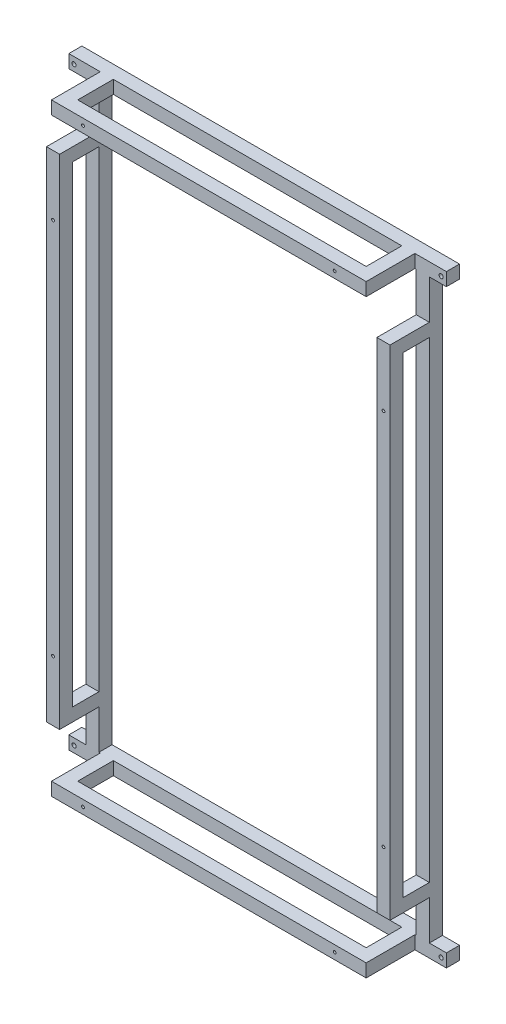
from build123d import *

# Parameters (mm, degrees)
ESQUISSE1_W                  = 720
ESQUISSE1_H                  = 25
BOSS_EXTRU_1_DEPTH           = 25
BOSS_EXTRU_1_2_DEPTH         = 25
ENL_V_MAT_EXTRU_1_DEPTH      = 25
ENL_V_MAT_EXTRU_1_DEPTH_BACK = 100
ESQUISSE2_R                  = 4
ESQUISSE3_W                  = 25
ESQUISSE3_H                  = 25
BOSS_EXTRU_2_DEPTH           = 68
ESQUISSE4_W                  = 600
ESQUISSE4_H                  = 25
BOSS_EXTRU_3_DEPTH           = 25
ESQUISSE5_R                  = 2.75
ENL_V_MAT_EXTRU_2_DEPTH      = 25
ESQUISSE6_W                  = 25
ESQUISSE6_H                  = 1100
BOSS_EXTRU_4_DEPTH           = 25
ESQUISSE7_W                  = 25
ESQUISSE7_H                  = 25
BOSS_EXTRU_5_DEPTH           = 50
ESQUISSE8_W                  = 25
ESQUISSE8_H                  = 950
BOSS_EXTRU_6_DEPTH           = 25
ESQUISSE9_R                  = 2.75
ENL_V_MAT_EXTRU_3_DEPTH      = 25


with BuildPart() as part:
    # Esquisse1 → Boss.-Extru.1 (new body)
    with BuildSketch(Plane.XY):
        with Locations((360, 12.5)):
            Rectangle(ESQUISSE1_W, ESQUISSE1_H)
    extrude(amount=BOSS_EXTRU_1_DEPTH)


with BuildPart() as body_2:
    # Esquisse1 → Boss.-Extru.1 2 (new body)
    with BuildSketch(Plane.XY):
        with Locations((360, -1112.5)):
            Rectangle(ESQUISSE1_W, ESQUISSE1_H)
    extrude(amount=BOSS_EXTRU_1_2_DEPTH)


with BuildPart() as enl_v_mat_extru_1_tool:
    # Esquisse2 → Enlèv. mat.-Extru.1 (new, two sides: drawn at the far end of the back side and taken through both)
    with BuildSketch(Plane.XY.offset(25).offset(-ENL_V_MAT_EXTRU_1_DEPTH_BACK)):
        with Locations(Location((10, 12.5, 0), (0, 0, 180))):
            Circle(ESQUISSE2_R)
        with Locations(Location((710, 12.5, 0), (0, 0, 180))):
            Circle(ESQUISSE2_R)
        with Locations(Location((710, -1112.5, 0), (0, 0, 180))):
            Circle(ESQUISSE2_R)
        with Locations(Location((10, -1112.5, 0), (0, 0, 180))):
            Circle(ESQUISSE2_R)
    extrude(amount=ENL_V_MAT_EXTRU_1_DEPTH + ENL_V_MAT_EXTRU_1_DEPTH_BACK)


with BuildPart() as part_1:
    add(part.part)

    # Enlèv. mat.-Extru.1: cut by enl_v_mat_extru_1_tool
    add(enl_v_mat_extru_1_tool.part, mode=Mode.SUBTRACT)



with BuildPart() as body_2_1:
    add(body_2.part)

    # Enlèv. mat.-Extru.1: cut by enl_v_mat_extru_1_tool
    add(enl_v_mat_extru_1_tool.part, mode=Mode.SUBTRACT)


with BuildPart() as part_2:
    add(part_1.part)

    add(body_2_1.part)  # Boss.-Extru.2 merges body 2
    # Esquisse3 → Boss.-Extru.2 (add)
    with BuildSketch(Plane.XY.offset(25)):
        with Locations((72.5, 12.5)):
            Rectangle(ESQUISSE3_W, ESQUISSE3_H)
        with Locations((647.5, 12.5)):
            Rectangle(ESQUISSE3_W, ESQUISSE3_H)
        with Locations((72.5, -1112.5)):
            Rectangle(ESQUISSE3_W, ESQUISSE3_H)
        with Locations((647.5, -1112.5)):
            Rectangle(ESQUISSE3_W, ESQUISSE3_H)
    extrude(amount=BOSS_EXTRU_2_DEPTH)

    # Esquisse4 → Boss.-Extru.3 (add)
    with BuildSketch(Plane.XY.offset(93)):
        with Locations((360, 12.5)):
            Rectangle(ESQUISSE4_W, ESQUISSE4_H)
        with Locations((360, -1112.5)):
            Rectangle(ESQUISSE4_W, ESQUISSE4_H)
    extrude(amount=BOSS_EXTRU_3_DEPTH)

    # Esquisse5 → Enlèv. mat.-Extru.2 (cut)
    with BuildSketch(Plane.XY.offset(118)):
        with Locations((120, 12.5)):
            Circle(ESQUISSE5_R)
        with Locations((600, 12.5)):
            Circle(ESQUISSE5_R)
        with Locations((600, -1112.5)):
            Circle(ESQUISSE5_R)
        with Locations((120, -1112.5)):
            Circle(ESQUISSE5_R)
    extrude(amount=-ENL_V_MAT_EXTRU_2_DEPTH, mode=Mode.SUBTRACT)

    # Esquisse6 → Boss.-Extru.4 (add)
    with BuildSketch(Plane(origin=(0, 0, 0), x_dir=(-1, 0, 0), z_dir=(0, 0, -1))):
        with Locations((-675, -550)):
            Rectangle(ESQUISSE6_W, ESQUISSE6_H)
        with Locations((-45, -550)):
            Rectangle(ESQUISSE6_W, ESQUISSE6_H)
    extrude(amount=-BOSS_EXTRU_4_DEPTH)

    # Esquisse7 → Boss.-Extru.5 (add)
    with BuildSketch(Plane.XY.offset(25)):
        with Locations((45, -1012.5)):
            Rectangle(ESQUISSE7_W, ESQUISSE7_H)
        with Locations((45, -87.5)):
            Rectangle(ESQUISSE7_W, ESQUISSE7_H)
        with Locations((675, -87.5)):
            Rectangle(ESQUISSE7_W, ESQUISSE7_H)
        with Locations((675, -1012.5)):
            Rectangle(ESQUISSE7_W, ESQUISSE7_H)
    extrude(amount=BOSS_EXTRU_5_DEPTH)

    # Esquisse8 → Boss.-Extru.6 (add)
    with BuildSketch(Plane.XY.offset(75)):
        with Locations((675, -550)):
            Rectangle(ESQUISSE8_W, ESQUISSE8_H)
        with Locations((45, -550)):
            Rectangle(ESQUISSE8_W, ESQUISSE8_H)
    extrude(amount=BOSS_EXTRU_6_DEPTH)

    # Esquisse9 → Enlèv. mat.-Extru.3 (cut)
    with BuildSketch(Plane.XY.offset(100)):
        with Locations((675, -910)):
            Circle(ESQUISSE9_R)
        with Locations((45, -910)):
            Circle(ESQUISSE9_R)
        with Locations((675, -190)):
            Circle(ESQUISSE9_R)
        with Locations((45, -190)):
            Circle(ESQUISSE9_R)
    extrude(amount=-ENL_V_MAT_EXTRU_3_DEPTH, mode=Mode.SUBTRACT)


solid = part_2.part
